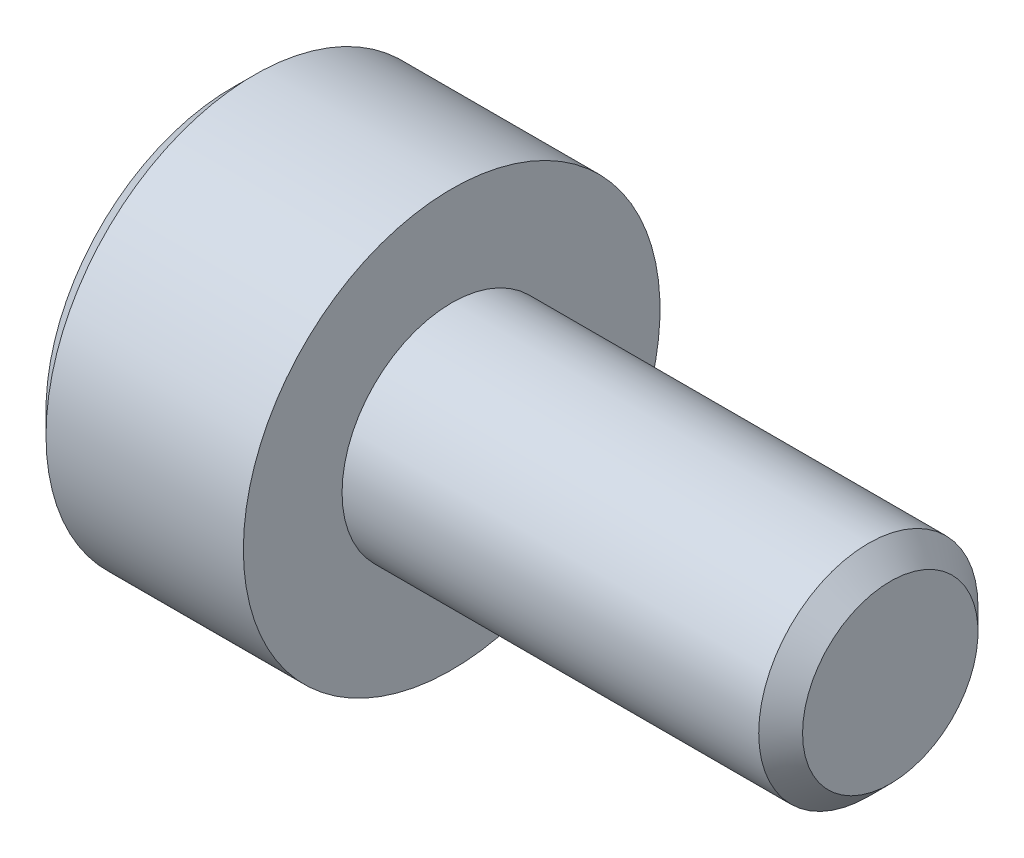
from build123d import *

# Parameters (mm, degrees)
CUT_EXTRUDE1_DEPTH = 1.27
CHAMFER1_SIZE      = 0.2


with BuildPart() as part:
    # Sketch1 → Revolve1 (revolve)
    with BuildSketch(Plane.XY, mode=Mode.PRIVATE) as revolve1_sk:
        Polygon((6, 0), (6, 1), (2, 1), (2, 1.9), (0, 1.9), (0, 0), align=None)
    revolve(revolve1_sk.sketch.rotate(Axis((0, 0, 0), (1, 0, 0)), 90), axis=Axis((0, 0, 0), (1, 0, 0)))

    # Sketch2 → Cut-Extrude1 (cut)
    with BuildSketch(Plane.ZY):
        Polygon((0.640246616, -1.108939669), (1.280493233, 0), (0.640246616, 1.108939669), (-0.640246616, 1.108939669), (-1.280493233, 0), (-0.640246616, -1.108939669), align=None)
    extrude(amount=-CUT_EXTRUDE1_DEPTH, mode=Mode.SUBTRACT)

    # Chamfer1
    chamfer1_edges = [part.edges().sort_by_distance(p)[0] for p in [
        (0, 0, -1.9),
        (6, 0, -1),
    ]]
    chamfer(chamfer1_edges, length=CHAMFER1_SIZE)


solid = part.part
